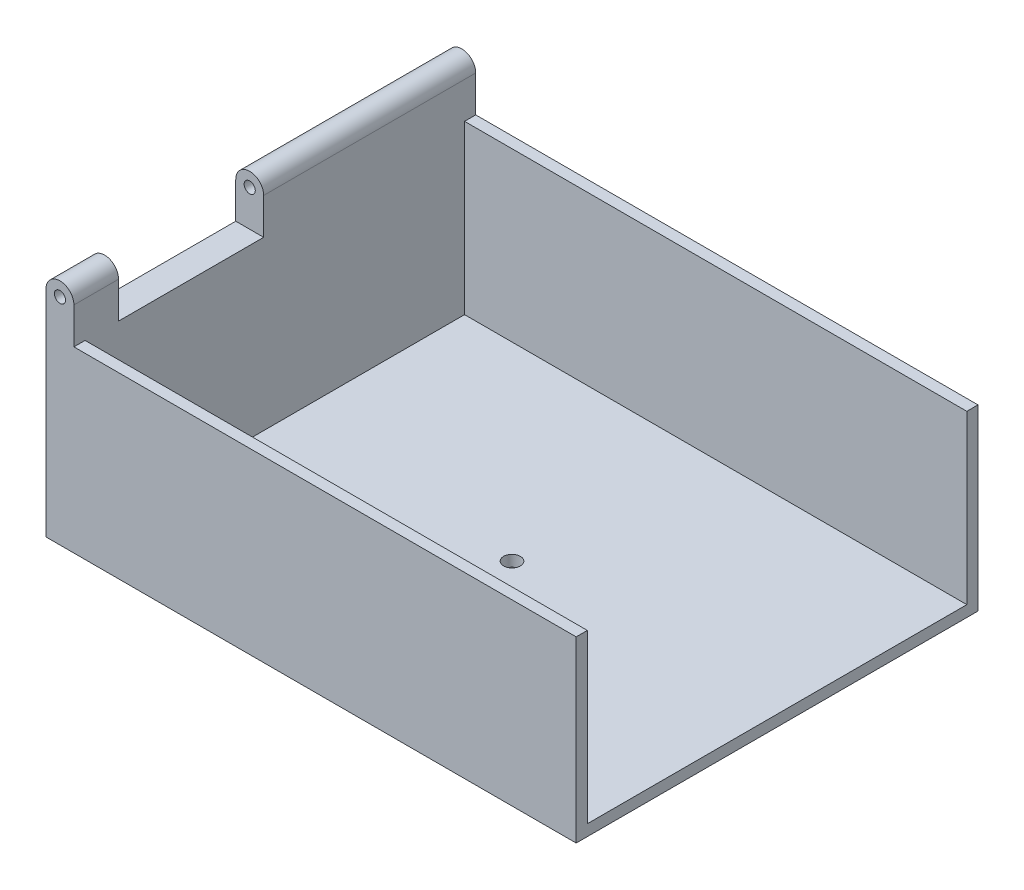
from build123d import *

# Parameters (mm, degrees)
SKETCH1_W               = 95
SKETCH1_H               = 72
BOSS_EXTRUDE1_DEPTH     = 35
SKETCH5_W               = 90
SKETCH5_H               = 68
CUT_EXTRUDE1_DEPTH      = 33
SKETCH10_R              = 1
BOSS_EXTRUDE5_DEPTH     = 72
CUT_EXTRUDE2_DEPTH      = 10
CUT_EXTRUDE2_DEPTH_BACK = 3
SKETCH19_W              = 5
SKETCH19_H              = 26
SKETCH20_W              = 90
SKETCH20_H              = 72
CUT_EXTRUDE3_DEPTH      = 3
SKETCH21_R              = 1.5
CUT_EXTRUDE4_DEPTH      = 72.226750593


with BuildPart() as part:
    # Sketch1 → Boss-Extrude1 (new body)
    with BuildSketch(Plane(origin=(0, 0, 0), x_dir=(1, 0, 0), z_dir=(0, 1, 0))):
        Rectangle(SKETCH1_W, SKETCH1_H)
    extrude(amount=BOSS_EXTRUDE1_DEPTH)

    # Sketch5 → Cut-Extrude1 (cut)
    with BuildSketch(Plane(origin=(0, 35, 0), x_dir=(1, 0, 0), z_dir=(0, 1, 0))):
        with Locations((2.5, 0)):
            Rectangle(SKETCH5_W, SKETCH5_H)
    extrude(amount=-CUT_EXTRUDE1_DEPTH, mode=Mode.SUBTRACT)

    # Sketch10 → Boss-Extrude5 (add, through all)
    with BuildSketch(Plane.XY.offset(36)):
        with BuildLine():
            Line((-42.5, 35), (-42.5, 38.5))
            ThreePointArc((-42.5, 38.5), (-45, 41), (-47.5, 38.5))
            Line((-47.5, 38.5), (-47.5, 35))
            Line((-47.5, 35), (-42.5, 35))
        make_face()
        with Locations((-45, 38.5)):
            Circle(SKETCH10_R, mode=Mode.SUBTRACT)
    extrude(amount=-BOSS_EXTRUDE5_DEPTH)

    # Sketch19 → Cut-Extrude2 (cut, two sides: drawn at the far end of the back side and taken through both)
    with BuildSketch(Plane(origin=(0, 35, 0), x_dir=(1, 0, 0), z_dir=(0, 1, 0)).offset(-CUT_EXTRUDE2_DEPTH_BACK)):
        with Locations((-45, -15)):
            Rectangle(SKETCH19_W, SKETCH19_H)
    extrude(amount=CUT_EXTRUDE2_DEPTH + CUT_EXTRUDE2_DEPTH_BACK, mode=Mode.SUBTRACT)

    # Sketch20 → Cut-Extrude3 (cut)
    with BuildSketch(Plane(origin=(0, 35, 0), x_dir=(1, 0, 0), z_dir=(0, 1, 0))):
        with Locations((2.5, 0)):
            Rectangle(SKETCH20_W, SKETCH20_H)
    extrude(amount=-CUT_EXTRUDE3_DEPTH, mode=Mode.SUBTRACT)

    # Sketch21 → Cut-Extrude4 (cut, through all)
    with BuildSketch(Plane(origin=(0, 2, 0), x_dir=(1, 0, 0), z_dir=(0, 1, 0))):
        with Locations(Location((0, 0, 0), (0, 0, 270))):
            Circle(SKETCH21_R)
    extrude(amount=-CUT_EXTRUDE4_DEPTH, mode=Mode.SUBTRACT)


solid = part.part
